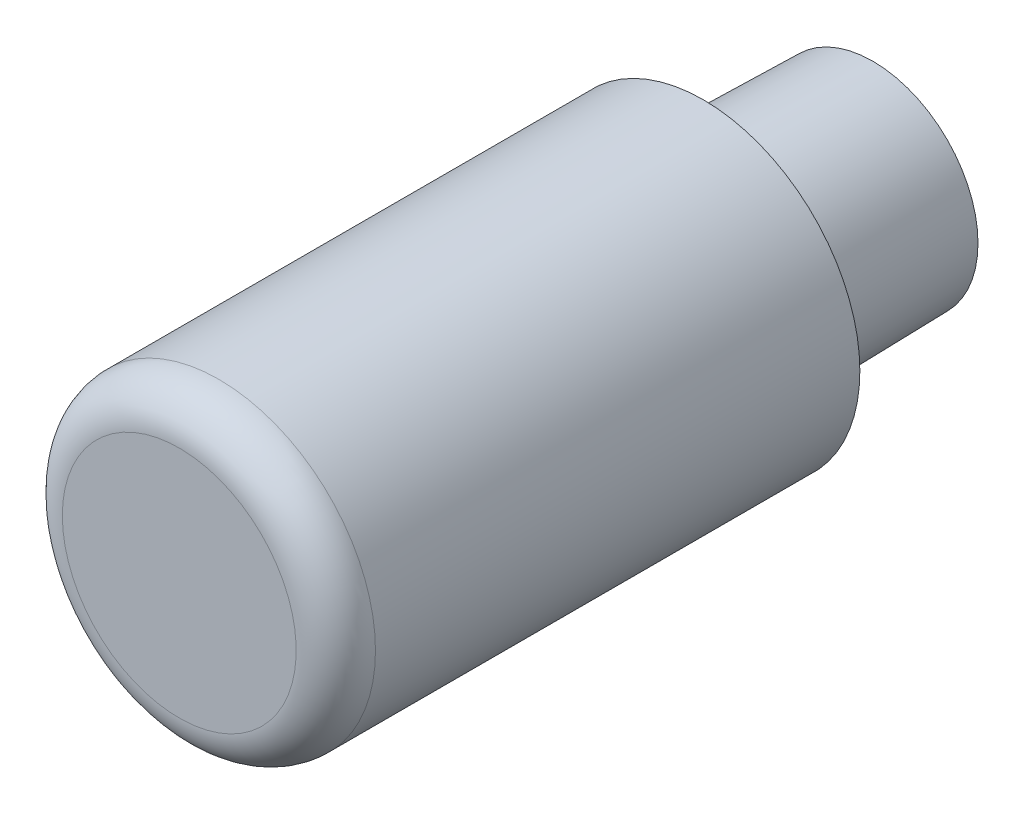
from build123d import *

# Parameters (mm, degrees)
FILLET1_R = 2.54


with BuildPart() as part:
    # Sketch1 → Revolve1 (revolve)
    with BuildSketch(Plane(origin=(0, 0, 0), x_dir=(0, 0, -1), z_dir=(1, 0, 0)), mode=Mode.PRIVATE) as revolve1_sk:
        Polygon((-38.6588, 0), (-38.6588, 10.033), (-5.08, 10.033), (-5.08, 6.9596), (5.7912, 6.731880822), (5.7912, 0), align=None)
    revolve(revolve1_sk.sketch.rotate(Axis((0, 0, 26.802982982), (0, 0, -1)), 90), axis=Axis((0, 0, 26.802982982), (0, 0, -1)))

    # Fillet1
    fillet1_edges = [part.edges().sort_by_distance(p)[0] for p in [
        (-10.033, 0, 38.6588),
    ]]
    fillet(fillet1_edges, radius=FILLET1_R)


solid = part.part
